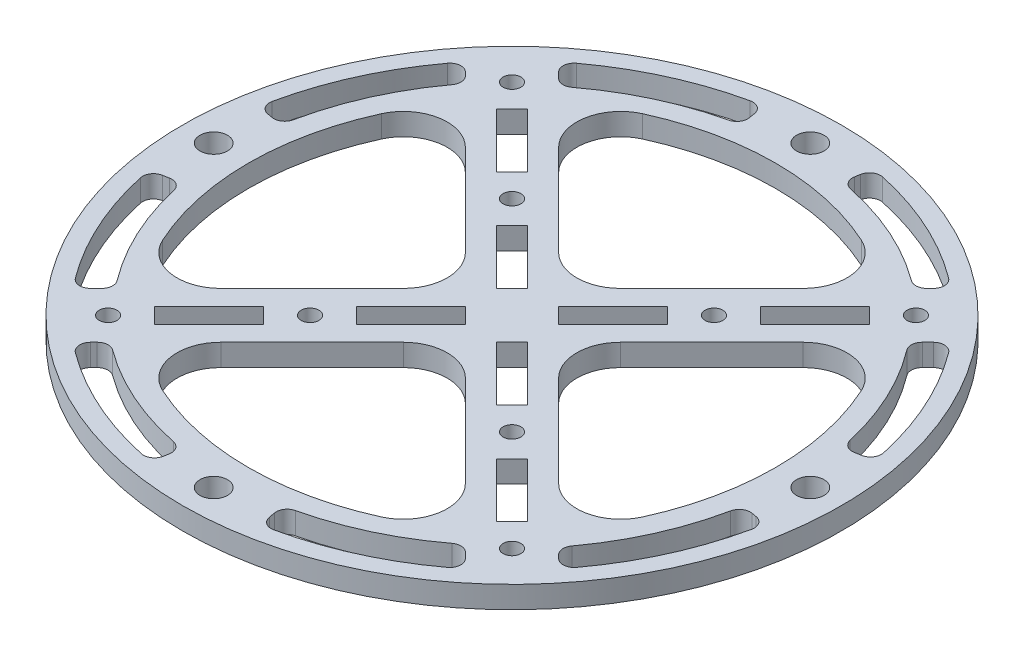
from build123d import *

# Parameters (mm, degrees)
SKETCH1_R           = 150
BOSS_EXTRUDE1_DEPTH = 10
SKETCH2_R           = 6.25
CUT_EXTRUDE1_DEPTH  = 213.367605816
SKETCH4_R           = 4.05
CUT_EXTRUDE2_DEPTH  = 213.367605816
CIRPATTERN1_COUNT   = 4
CUT_EXTRUDE3_DEPTH  = 213.367605816
CIRPATTERN2_COUNT   = 4
FILLET1_R           = 20
FILLET2_R           = 5


with BuildPart() as part:
    # Sketch1 → Boss-Extrude1 (new body)
    with BuildSketch(Plane(origin=(0, 0, 0), x_dir=(1, 0, 0), z_dir=(0, 1, 0))):
        with Locations(Location((0, 0, 0), (0, 0, 270))):
            Circle(SKETCH1_R)
    extrude(amount=BOSS_EXTRUDE1_DEPTH)

    # Sketch2 → Cut-Extrude1 (cut, through all)
    with BuildSketch(Plane(origin=(0, 10, 0), x_dir=(1, 0, 0), z_dir=(0, 1, 0))):
        with Locations(Location((-135.764501988, 0, 0), (0, 0, 270))):
            Circle(SKETCH2_R)
        with Locations(Location((0, -135.764501988, 0), (0, 0, 270))):
            Circle(SKETCH2_R)
        with Locations(Location((135.764501988, 0, 0), (0, 0, 270))):
            Circle(SKETCH2_R)
        with Locations(Location((0, 135.764501988, 0), (0, 0, 270))):
            Circle(SKETCH2_R)
    extrude(amount=-CUT_EXTRUDE1_DEPTH, mode=Mode.SUBTRACT)

    # Sketch4 → Cut-Extrude2 (cut, through all)
    with BuildSketch(Plane(origin=(0, 10, 0), x_dir=(1, 0, 0), z_dir=(0, 1, 0))):
        with Locations(Location((-45.961940777, 45.961940777, 0), (0, 0, 270))):
            Circle(SKETCH4_R)
        with Locations(Location((-91.923881554, 91.923881554, 0), (0, 0, 270))):
            Circle(SKETCH4_R)
        Polygon((-31.819805153, 38.890872965), (-7.071067812, 14.142135624), (-14.142135624, 7.071067812), (-38.890872965, 31.819805153), align=None)
        Polygon((-77.781745931, 84.852813742), (-53.033008589, 60.104076401), (-60.104076401, 53.033008589), (-84.852813742, 77.781745931), align=None)
    cut_extrude2 = extrude(amount=-CUT_EXTRUDE2_DEPTH, mode=Mode.SUBTRACT)

    # CirPattern1: Cut-Extrude2 ×4 about axis
    cirpattern1_axis = Axis((0, 0, 0), (0, 1, 0))
    for i in range(1, CIRPATTERN1_COUNT):
        add(cut_extrude2.rotate(cirpattern1_axis, i * 360 / CIRPATTERN1_COUNT), mode=Mode.SUBTRACT)

    # Sketch5 → Cut-Extrude3 (cut, through all)
    with BuildSketch(Plane(origin=(0, 10, 0), x_dir=(1, 0, 0), z_dir=(0, 1, 0))):
        with BuildLine():
            Line((-118.176930361, 20.83778132), (-25.754398819, 4.541195384))
            Line((-25.754398819, 4.541195384), (-94.79389292, 73.580689485))
            ThreePointArc((-94.79389292, 73.580689485), (-109.702308466, 48.635414229), (-118.176930361, 20.83778132))
        make_face()
        with BuildLine():
            Line((-26.467048828, -5.253845392), (-21.213203436, 0))
            Line((-21.213203436, 0), (-25.754398819, 4.541195384))
            Line((-25.754398819, 4.541195384), (-118.176930361, 20.83778132))
            ThreePointArc((-118.176930361, 20.83778132), (-119.999651906, -0.289037278), (-118.075177837, -21.406830189))
            Line((-118.075177837, -21.406830189), (-26.467048828, -5.253845392))
        make_face()
        with BuildLine():
            Line((-94.79389292, -73.580689485), (-26.467048828, -5.253845392))
            Line((-26.467048828, -5.253845392), (-118.075177837, -21.406830189))
            ThreePointArc((-118.075177837, -21.406830189), (-109.584844845, -48.899506953), (-94.79389292, -73.580689485))
        make_face()
        with BuildLine():
            Line((-110.49234913, -89.279145695), (-100.844773372, -79.631569936))
            ThreePointArc((-100.844773372, -79.631569936), (-117.524998306, -52.953330181), (-127.210900383, -23.017704562))
            Line((-127.210900383, -23.017704562), (-139.79429292, -25.236496175))
            ThreePointArc((-139.79429292, -25.236496175), (-129.175137068, -59.102529858), (-110.49234913, -89.279145695))
        make_face()
        with BuildLine():
            ThreePointArc((-127.73809358, 22.523672362), (-118.497283645, 53.24384661), (-101.924670235, 80.7114668))
            Line((-101.924670235, 80.7114668), (-110.49234913, 89.279145695))
            ThreePointArc((-110.49234913, 89.279145695), (-129.295125536, 58.839574989), (-139.89583256, 24.667409769))
            Line((-139.89583256, 24.667409769), (-127.73809358, 22.523672362))
        make_face()
    cut_extrude3 = extrude(amount=-CUT_EXTRUDE3_DEPTH, mode=Mode.SUBTRACT)

    # CirPattern2: Cut-Extrude3 ×4 about axis
    cirpattern2_axis = Axis((0, 0, 0), (0, 1, 0))
    for i in range(1, CIRPATTERN2_COUNT):
        add(cut_extrude3.rotate(cirpattern2_axis, i * 360 / CIRPATTERN2_COUNT), mode=Mode.SUBTRACT)

    # Fillet1
    fillet1_edges = [part.edges().sort_by_distance(p)[0] for p in [
        (-94.79389292, 5, -73.580689485),
        (-21.213203436, 5, 0),
        (-94.79389292, 5, 73.580689485),
        (94.79389292, 5, 73.580689485),
        (21.213203436, 5, 0),
        (94.79389292, 5, -73.580689485),
        (-73.580689485, 5, 94.79389292),
        (0, 5, 21.213203436),
        (73.580689485, 5, 94.79389292),
        (73.580689485, 5, -94.79389292),
        (0, 5, -21.213203436),
        (-73.580689485, 5, -94.79389292),
    ]]
    fillet(fillet1_edges, radius=FILLET1_R)

    # Fillet2
    fillet2_edges = [part.edges().sort_by_distance(p)[0] for p in [
        (-101.924670235, 5, -80.7114668),
        (-127.73809358, 5, -22.523672362),
        (-139.89583256, 5, -24.667409769),
        (-110.49234913, 5, -89.279145695),
        (-127.210900383, 5, 23.017704562),
        (-100.844773372, 5, 79.631569936),
        (-110.49234913, 5, 89.279145695),
        (-139.79429292, 5, 25.236496175),
        (-23.017704562, 5, -127.210900383),
        (-79.631569936, 5, -100.844773372),
        (-89.279145695, 5, -110.49234913),
        (-25.236496175, 5, -139.79429292),
        (80.7114668, 5, -101.924670235),
        (22.523672362, 5, -127.73809358),
        (24.667409769, 5, -139.89583256),
        (89.279145695, 5, -110.49234913),
        (127.210900383, 5, -23.017704562),
        (100.844773372, 5, -79.631569936),
        (110.49234913, 5, -89.279145695),
        (139.79429292, 5, -25.236496175),
        (-80.7114668, 5, 101.924670235),
        (-22.523672362, 5, 127.73809358),
        (-24.667409769, 5, 139.89583256),
        (-89.279145695, 5, 110.49234913),
        (23.017704562, 5, 127.210900383),
        (79.631569936, 5, 100.844773372),
        (89.279145695, 5, 110.49234913),
        (25.236496175, 5, 139.79429292),
        (101.924670235, 5, 80.7114668),
        (127.73809358, 5, 22.523672362),
        (139.89583256, 5, 24.667409769),
        (110.49234913, 5, 89.279145695),
    ]]
    fillet(fillet2_edges, radius=FILLET2_R)


solid = part.part
